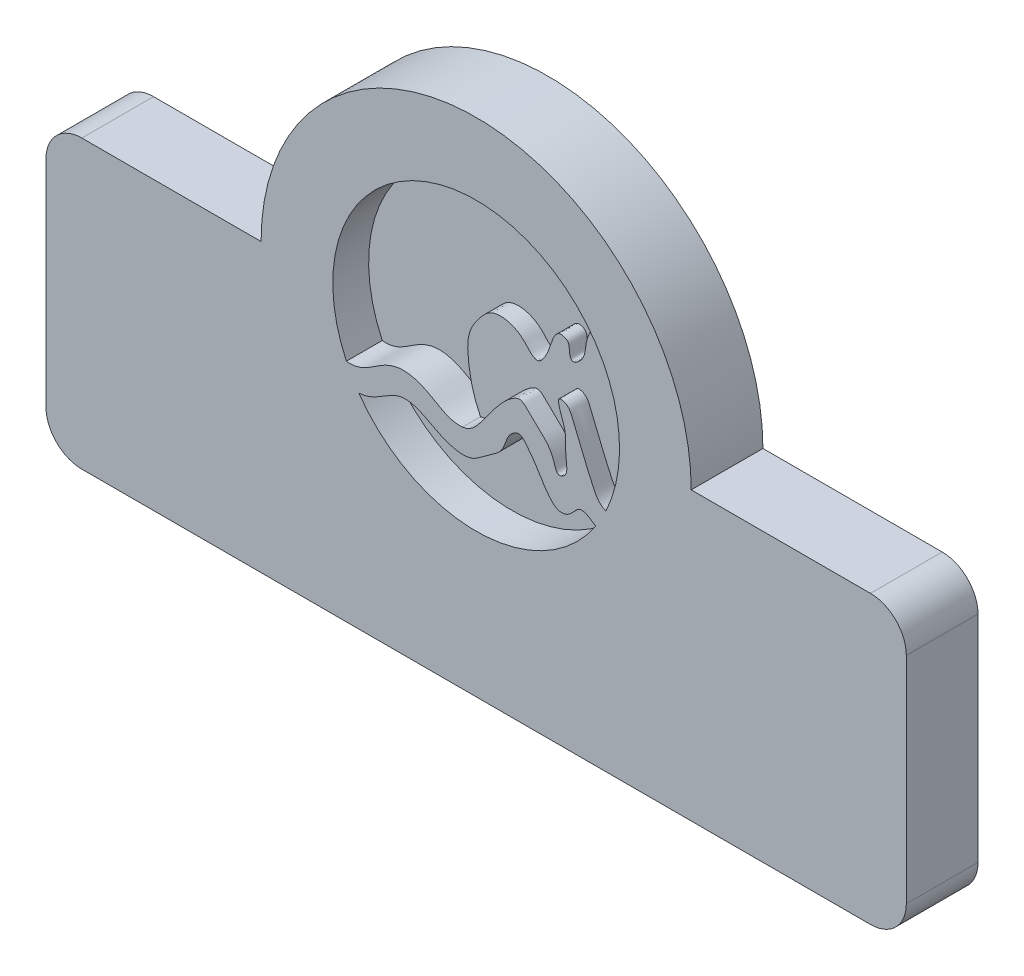
from build123d import *

# Parameters (mm, degrees)
BOSS_EXTRUDE3_DEPTH = 6.35
CUT_EXTRUDE2_START  = 6.35
CUT_EXTRUDE2_DEPTH  = 3.175
CUT_EXTRUDE4_START  = 6.35
CUT_EXTRUDE4_DEPTH  = 1.5875
FILLET1_R           = 3.175


with BuildPart() as part:
    # Sketch1 → Boss-Extrude3 (new body)
    with BuildSketch(Plane.XY):
        with BuildLine():
            Line((35.78531497, 16.139458277), (54.83531497, 16.139458277))
            Line((54.83531497, 16.139458277), (54.83531497, -9.260541723))
            Line((54.83531497, -9.260541723), (-21.36468503, -9.260541723))
            Line((-21.36468503, -9.260541723), (-21.36468503, 16.139458277))
            Line((-21.36468503, 16.139458277), (-2.31468503, 16.139458277))
            ThreePointArc((-2.31468503, 16.139458277), (16.73531497, 35.189458277), (35.78531497, 16.139458277))
        make_face()
    extrude(amount=BOSS_EXTRUDE3_DEPTH)

    # Sketch2 → Cut-Extrude2 (cut)
    with BuildSketch(Plane.XY.offset(CUT_EXTRUDE2_START)):
        with BuildLine():
            ThreePointArc((26.686575031, 24.030112445), (12.557456834, 28.13260221), (4.03531497, 16.139458279))
            ThreePointArc((4.03531497, 16.139458279), (4.34070144, 13.37114553), (5.242174099, 10.735967468))
            add(Edge.make_bspline(
                [(5.242174099, 10.735967468), (6.71809569, 10.558336312), (7.918117514, 12.03347609), (10.468854722, 12.765944744), (12.442903728, 12.098140871), (13.961959658, 10.988070936), (15.124564972, 10.779857682), (15.530263626, 10.828286766)],
                knots=[0, 0, 0, 0, 0.103449195, 0.139241601, 0.205578262, 0.258601603, 0.291638302, 0.291638302, 0.291638302, 0.291638302], degree=3))
            add(Edge.make_bspline(
                [(15.530263626, 10.828286766), (14.893940081, 12.095087951), (14.438868342, 13.981262833), (14.343537675, 16.73425729), (15.269082011, 18.244723048), (16.506241707, 19.50741569), (18.140034136, 19.466216754), (19.332002745, 18.736180633), (19.902448165, 17.965467921), (20.681743122, 17.471570607), (21.448331705, 18.509031687), (21.733369869, 19.503537614), (22.291305084, 20.939072019), (23.514109208, 20.496889567), (23.332972834, 19.735543014), (23.678738278, 18.951349284), (24.892829136, 19.856633997), (24.704069783, 21.798562579), (25.937040799, 23.315779233), (26.686575031, 24.030112445)],
                knots=[0, 0, 0, 0, 0.163826768, 0.228294741, 0.314759461, 0.363733255, 0.427293954, 0.487534152, 0.520272147, 0.543412507, 0.580045633, 0.637017643, 0.689480468, 0.715613554, 0.754599818, 0.768000956, 0.802503201, 0.870835866, 1, 1, 1, 1], degree=3))
        make_face()
        with BuildLine():
            add(Edge.make_bspline(
                [(6.341335519, 8.841842832), (7.352948834, 8.892765558), (8.439747543, 9.720370574), (10.078322822, 10.548282172), (11.601579158, 10.336773716), (13.010418282, 9.479262177), (14.602994521, 8.760069852), (16.353851818, 8.627242763), (17.638059992, 9.776964582), (19.252211745, 10.645536154), (19.40833239, 12.251159057), (20.601947199, 13.020559931), (21.506732859, 11.937828164), (22.289818404, 10.79448645), (23.033017647, 9.455226836), (23.985183437, 8.541384721), (25.178521672, 8.783631752), (25.858053706, 10.236382277), (27.020441322, 9.326768086), (27.324222726, 9.127680149)],
                knots=[0, 0, 0, 0, 0.111111506, 0.158804473, 0.207674807, 0.281442738, 0.349358567, 0.412439169, 0.469148104, 0.544608443, 0.609896851, 0.643348875, 0.677969984, 0.748784791, 0.815450656, 0.856726934, 0.888904639, 0.942631222, 1, 1, 1, 1], degree=3))
            ThreePointArc((6.341335519, 8.841842832), (16.90830342, 3.440636481), (27.324222726, 9.127680149))
        make_face()
    extrude(amount=-CUT_EXTRUDE2_DEPTH, mode=Mode.SUBTRACT)

    # Sketch4 → Cut-Extrude4 (cut)
    with BuildSketch(Plane.XY.offset(CUT_EXTRUDE4_START)):
        with BuildLine():
            ThreePointArc((26.686575031, 24.030112445), (12.557456834, 28.13260221), (4.03531497, 16.139458279))
            ThreePointArc((4.03531497, 16.139458279), (4.34070144, 13.37114553), (5.242174099, 10.735967468))
            add(Edge.make_bspline(
                [(5.242174099, 10.735967468), (6.71809569, 10.558336312), (7.918117514, 12.03347609), (10.468854722, 12.765944744), (12.442903728, 12.098140871), (13.961959658, 10.988070936), (15.124564972, 10.779857682), (15.530263626, 10.828286766)],
                knots=[0, 0, 0, 0, 0.103449195, 0.139241601, 0.205578262, 0.258601603, 0.291638302, 0.291638302, 0.291638302, 0.291638302], degree=3))
            add(Edge.make_bspline(
                [(15.530263626, 10.828286766), (14.893940081, 12.095087951), (14.438868342, 13.981262833), (14.343537675, 16.73425729), (15.269082011, 18.244723048), (16.506241707, 19.50741569), (18.140034136, 19.466216754), (19.332002745, 18.736180633), (19.902448165, 17.965467921), (20.681743122, 17.471570607), (21.448331705, 18.509031687), (21.733369869, 19.503537614), (22.291305084, 20.939072019), (23.514109208, 20.496889567), (23.332972834, 19.735543014), (23.678738278, 18.951349284), (24.892829136, 19.856633997), (24.704069783, 21.798562579), (25.937040799, 23.315779233), (26.686575031, 24.030112445)],
                knots=[0, 0, 0, 0, 0.163826768, 0.228294741, 0.314759461, 0.363733255, 0.427293954, 0.487534152, 0.520272147, 0.543412507, 0.580045633, 0.637017643, 0.689480468, 0.715613554, 0.754599818, 0.768000956, 0.802503201, 0.870835866, 1, 1, 1, 1], degree=3))
        make_face()
        with BuildLine():
            ThreePointArc((28.22845584, 10.735967468), (29.129928498, 13.371145529), (29.43531497, 16.139458277))
            ThreePointArc((29.43531497, 16.139458277), (28.728458902, 20.317316414), (26.686575031, 24.030112445))
            add(Edge.make_bspline(
                [(15.530263626, 10.828286766), (14.893940081, 12.095087951), (14.438868342, 13.981262833), (14.343537675, 16.73425729), (15.269082011, 18.244723048), (16.506241707, 19.50741569), (18.140034136, 19.466216754), (19.332002745, 18.736180633), (19.902448165, 17.965467921), (20.681743122, 17.471570607), (21.448331705, 18.509031687), (21.733369869, 19.503537614), (22.291305084, 20.939072019), (23.514109208, 20.496889567), (23.332972834, 19.735543014), (23.678738278, 18.951349284), (24.892829136, 19.856633997), (24.704069783, 21.798562579), (25.937040799, 23.315779233), (26.686575031, 24.030112445)],
                knots=[0, 0, 0, 0, 0.163826768, 0.228294741, 0.314759461, 0.363733255, 0.427293954, 0.487534152, 0.520272147, 0.543412507, 0.580045633, 0.637017643, 0.689480468, 0.715613554, 0.754599818, 0.768000956, 0.802503201, 0.870835866, 1, 1, 1, 1], degree=3))
            add(Edge.make_bspline(
                [(15.530263626, 10.828286766), (15.626387534, 10.839761274), (16.489777481, 11.011623424), (17.499150898, 12.517877657), (18.687719037, 14.101458352), (19.657939915, 15.107245777), (20.736594209, 15.671140337), (21.592414385, 14.657430773), (22.718560515, 13.747508546), (23.569829513, 12.703280038), (23.862593949, 11.274580766), (24.95336238, 11.697819528), (24.5406586, 13.349786862), (24.808258039, 15.139757069), (24.095016856, 16.301161897), (23.99892435, 17.331566416), (24.934028737, 17.313329169), (25.368213122, 16.039497011), (25.991460724, 14.726460411), (26.406764207, 13.484600275), (27.128521052, 12.146063772), (27.369998366, 11.103966692), (28.22845584, 10.735967468)],
                knots=[0.291638302, 0.291638302, 0.291638302, 0.291638302, 0.299465828, 0.363653171, 0.418235104, 0.461509401, 0.476757706, 0.506042886, 0.54840923, 0.597041835, 0.622241463, 0.63200319, 0.675047866, 0.726967039, 0.779124266, 0.786558575, 0.795901318, 0.835776716, 0.878715553, 0.917236667, 0.938498416, 1, 1, 1, 1], degree=3))
        make_face()
    extrude(amount=-CUT_EXTRUDE4_DEPTH, mode=Mode.SUBTRACT)

    # Fillet1
    fillet1_edges = [part.edges().sort_by_distance(p)[0] for p in [
        (54.83531497, 16.139458277, 3.175),
        (54.83531497, -9.260541723, 3.175),
        (-21.36468503, -9.260541723, 3.175),
        (-21.36468503, 16.139458277, 3.175),
    ]]
    fillet(fillet1_edges, radius=FILLET1_R)


solid = part.part
